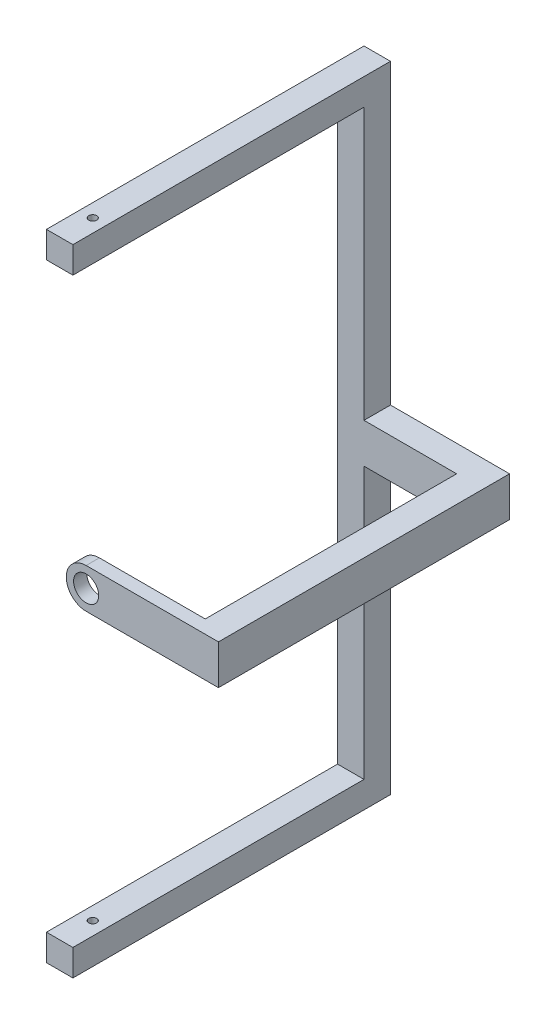
from build123d import *

# Parameters (mm, degrees)
SKETCH_1_R          = 9.5
EXTRUDE_1_DEPTH     = 10
SKETCH_2_W          = 20
SKETCH_2_H          = 30
EXTRUDE_2_DEPTH     = 210
SKETCH_3_W          = 20
SKETCH_3_H          = 30
EXTRUDE_3_DEPTH     = 70
EXTRUDE_4_DEPTH     = 20
SKETCH_5_R          = 3
CUT_EXTRUDE_1_DEPTH = 20


with BuildPart() as part:
    # 草图1 → 凸台-拉伸1 (new body)
    with BuildSketch(Plane.XY):
        with BuildLine():
            Line((0, 15), (100, 15))
            Line((100, 15), (100, -15))
            Line((100, -15), (0, -15))
            ThreePointArc((0, -15), (-15, 0), (0, 15))
        make_face()
        Circle(SKETCH_1_R, mode=Mode.SUBTRACT)
    extrude(amount=EXTRUDE_1_DEPTH)

    # 草图2 → 凸台-拉伸2 (add)
    with BuildSketch(Plane(origin=(0, 0, 0), x_dir=(-1, 0, 0), z_dir=(0, 0, -1))):
        with Locations((-90, 0)):
            Rectangle(SKETCH_2_W, SKETCH_2_H)
    extrude(amount=EXTRUDE_2_DEPTH)

    # 草图3 → 凸台-拉伸3 (add)
    with BuildSketch(Plane.ZY.offset(-80)):
        with Locations((-200, 0)):
            Rectangle(SKETCH_3_W, SKETCH_3_H)
    extrude(amount=EXTRUDE_3_DEPTH)

    # 草图4 → 凸台-拉伸4 (add)
    with BuildSketch(Plane.ZY.offset(-10)):
        Polygon((-190, 0), (-190, -220), (30, -220), (30, -240), (-210, -240), (-210, 0), align=None)
    extrude_4 = extrude(amount=EXTRUDE_4_DEPTH)

    # 镜向1: 凸台-拉伸4 across plane
    add(extrude_4.mirror(Plane(origin=(-10, 0, -210), x_dir=(0, 0, 1), z_dir=(0, -1, 0))))

    # 草图5 → 切除-拉伸1 (cut)
    with BuildSketch(Plane(origin=(0, -220, 0), x_dir=(1, 0, 0), z_dir=(0, 1, 0))):
        with Locations((0, -5)):
            Circle(SKETCH_5_R)
    cut_extrude_1 = extrude(amount=-CUT_EXTRUDE_1_DEPTH, mode=Mode.SUBTRACT)

    # 镜向2: 切除-拉伸1 across plane
    add(cut_extrude_1.mirror(Plane.ZX), mode=Mode.SUBTRACT)


solid = part.part
